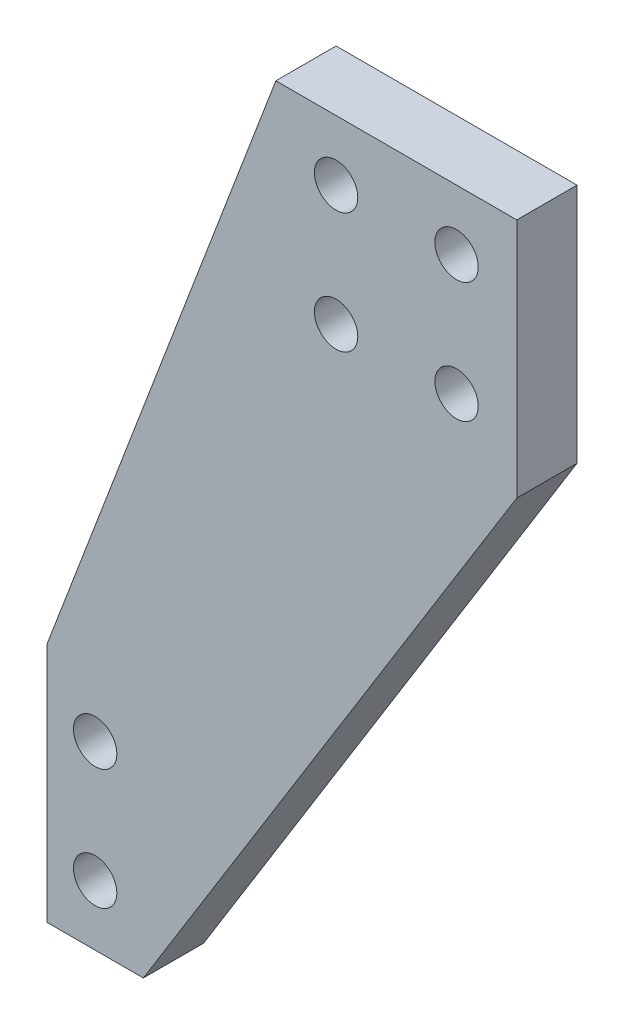
from build123d import *

# Parameters (mm, degrees)
SKETCH1_R           = 2.286
BOSS_EXTRUDE1_DEPTH = 6.35


with BuildPart() as part:
    # Sketch1 → Boss-Extrude1 (new body)
    with BuildSketch(Plane.XY):
        Polygon((0, 0), (24.13, 63.5), (49.53, 63.5), (49.53, 38.1), (10.16, -25.4), (0, -25.4), align=None)
        with Locations((5.08, -19.05)):
            Circle(SKETCH1_R, mode=Mode.SUBTRACT)
        with Locations((5.08, -6.35)):
            Circle(SKETCH1_R, mode=Mode.SUBTRACT)
        with Locations((43.18, 57.15)):
            Circle(SKETCH1_R, mode=Mode.SUBTRACT)
        with Locations((30.48, 57.15)):
            Circle(SKETCH1_R, mode=Mode.SUBTRACT)
        with Locations((30.48, 44.45)):
            Circle(SKETCH1_R, mode=Mode.SUBTRACT)
        with Locations((43.18, 44.45)):
            Circle(SKETCH1_R, mode=Mode.SUBTRACT)
    extrude(amount=BOSS_EXTRUDE1_DEPTH)


solid = part.part
